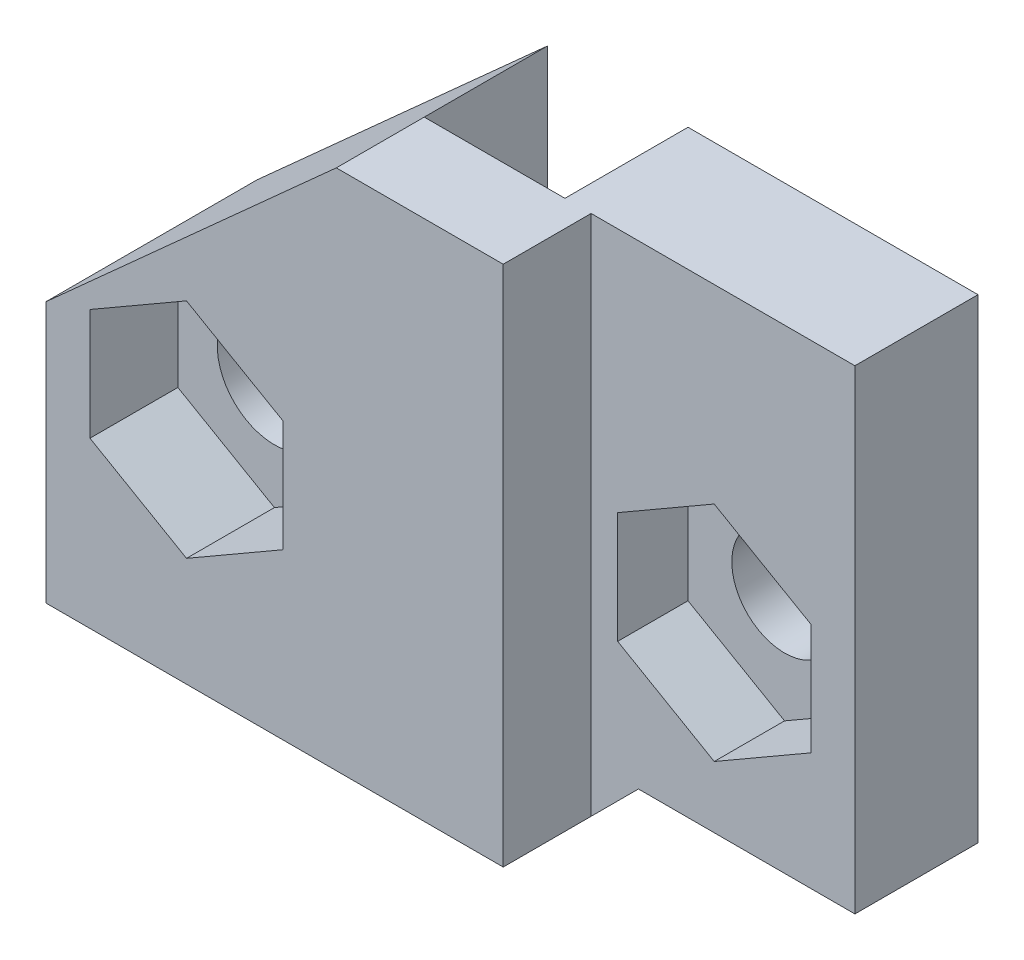
from build123d import *

# Parameters (mm, degrees)
CROQUIS1_R                   = 1.5
SALIENTE_EXTRUIR1_DEPTH      = 3.5
CORTAR_EXTRUIR1_DEPTH        = 2
SALIENTE_EXTRUIR2_DEPTH      = 2.5
SALIENTE_EXTRUIR2_DEPTH_BACK = 3.5
CROQUIS3_R                   = 1.625
CROQUIS4_W                   = 4
CROQUIS4_H                   = 8.575
SALIENTE_EXTRUIR3_DEPTH      = 2.5
CORTAR_EXTRUIR2_DEPTH        = 2.5


with BuildPart() as part:
    # Croquis1 → Saliente-Extruir1 (new body)
    with BuildSketch(Plane.XY):
        Polygon((88.732371, -80.148646), (88.732371, -81.493646), (90.077371, -80.148646), (96.232371, -80.148646), (96.232371, -66.648646), (88.732371, -66.648646), align=None)
        with Locations((92.232371, -75.223646)):
            Circle(CROQUIS1_R, mode=Mode.SUBTRACT)
    extrude(amount=SALIENTE_EXTRUIR1_DEPTH)

    # Croquis2 → Cortar-Extruir1 (cut)
    with BuildSketch(Plane.XY.offset(3.5)):
        Polygon((92.232371, -72.053646), (89.48707047, -73.638646), (89.48707047, -76.808646), (92.232371, -78.393646), (94.97767153, -76.808646), (94.97767153, -73.638646), align=None)
    extrude(amount=-CORTAR_EXTRUIR1_DEPTH, mode=Mode.SUBTRACT)

    # Croquis3 → Saliente-Extruir2 (add, two sides: drawn at the far end of the back side and taken through both)
    with BuildSketch(Plane.XY.offset(3.5).offset(-SALIENTE_EXTRUIR2_DEPTH_BACK)):
        Polygon((88.732371, -81.493646), (75.732371, -81.493646), (75.732371, -74.071146), (83.98707047, -66.648646), (83.98707047, -75.223646), (87.98707047, -75.223646), (87.98707047, -66.648646), (88.732371, -66.648646), align=None)
        with Locations((79.72767153, -75.223646)):
            Circle(CROQUIS3_R, mode=Mode.SUBTRACT)
    extrude(amount=SALIENTE_EXTRUIR2_DEPTH + SALIENTE_EXTRUIR2_DEPTH_BACK)

    # Croquis4 → Saliente-Extruir3 (add)
    with BuildSketch(Plane.XY.offset(6)):
        with Locations((85.98707047, -70.936146)):
            Rectangle(CROQUIS4_W, CROQUIS4_H)
    extrude(amount=-SALIENTE_EXTRUIR3_DEPTH)

    # Croquis5 → Cortar-Extruir2 (cut)
    with BuildSketch(Plane.XY.offset(6)):
        Polygon((79.72767153, -78.393646), (82.47297206, -76.808646), (82.47297206, -73.638646), (79.72767153, -72.053646), (76.982371, -73.638646), (76.982371, -76.808646), align=None)
    extrude(amount=-CORTAR_EXTRUIR2_DEPTH, mode=Mode.SUBTRACT)


solid = part.part
